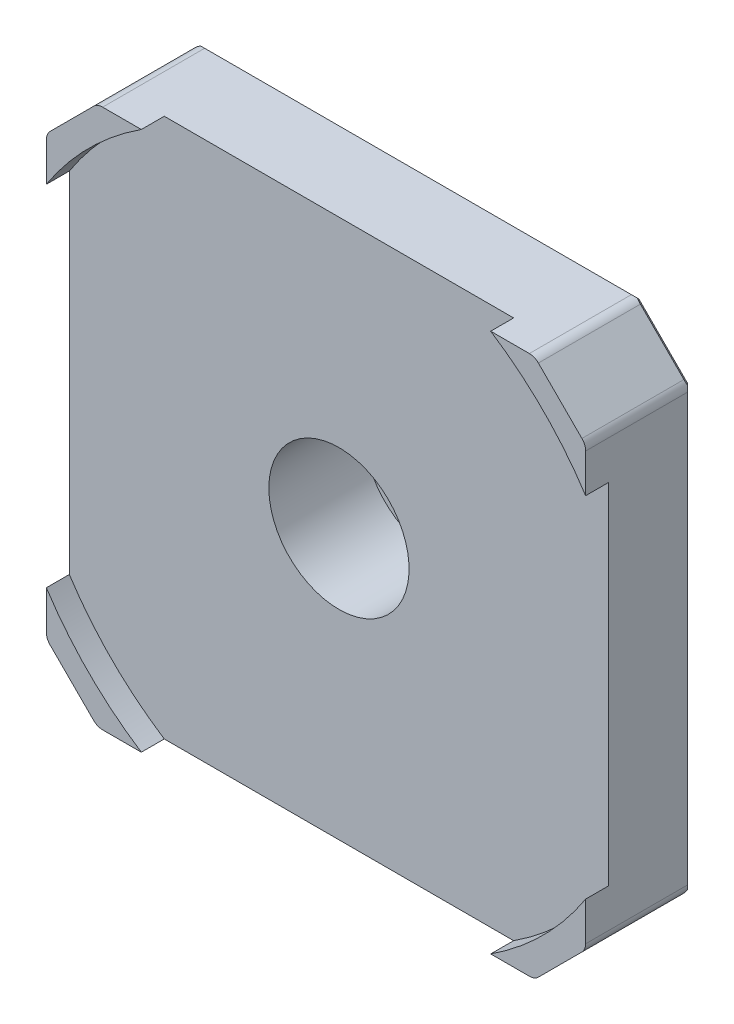
from build123d import *

# Parameters (mm, degrees)
SALIENTE_EXTRUIR1_DEPTH     = 6.5
CROQUIS3_R                  = 11
SALIENTE_EXTRUIR2_DEPTH     = 2
CROQUIS4_R                  = 4.5
CORTAR_EXTRUIR2_DEPTH       = 1
CROQUIS5_R                  = 5.5
CORTAR_EXTRUIR3_DEPTH       = 10
REDONDEO2_SIZE              = 0.3
REDONDEO3_R                 = 0.2
HOLE_WIZARD_M31_D           = 2.5
HOLE_WIZARD_M31_DEPTH       = 5
HOLE_WIZARD_M31_CSINK_D     = 3.6
HOLE_WIZARD_M31_CSINK_ANGLE = 90
HOLE_WIZARD_M31_TIP         = 0.751075774
FILLET_1_R                  = 1
EXTRUDE_START               = 1.8
EXTRUDE_1_DEPTH             = 1.8


with BuildPart() as part:
    # Croquis1 → Saliente-Extruir1 (new body)
    with BuildSketch(Plane.XY):
        Polygon((-21.15, 17.15), (-17.15, 21.15), (17.15, 21.15), (21.15, 17.15), (21.15, -17.15), (17.15, -21.15), (-17.15, -21.15), (-21.15, -17.15), align=None)
    extrude(amount=SALIENTE_EXTRUIR1_DEPTH)

    # Croquis3 → Saliente-Extruir2 (add)
    with BuildSketch(Plane(origin=(0, 0, 0), x_dir=(-1, 0, 0), z_dir=(0, 0, -1))):
        Circle(CROQUIS3_R)
    extrude(amount=SALIENTE_EXTRUIR2_DEPTH)

    # Croquis4 → Cortar-Extruir2 (cut)
    with BuildSketch(Plane(origin=(0, 0, -2), x_dir=(-1, 0, 0), z_dir=(0, 0, -1))):
        Circle(CROQUIS4_R)
    extrude(amount=-CORTAR_EXTRUIR2_DEPTH, mode=Mode.SUBTRACT)

    # Croquis5 → Cortar-Extruir3 (cut)
    with BuildSketch(Plane(origin=(0, 0, -1), x_dir=(-1, 0, 0), z_dir=(0, 0, -1))):
        Circle(CROQUIS5_R)
    extrude(amount=-CORTAR_EXTRUIR3_DEPTH, mode=Mode.SUBTRACT)

    # Redondeo2
    redondeo2_edges = [part.edges().sort_by_distance(p)[0] for p in [
        (-19.15, 19.15, 0),
        (0, 21.15, 0),
        (19.15, 19.15, 0),
        (21.15, 0, 0),
        (19.15, -19.15, 0),
        (0, -21.15, 0),
        (-19.15, -19.15, 0),
        (-21.15, 0, 0),
    ]]
    chamfer(redondeo2_edges, length=REDONDEO2_SIZE)

    # Redondeo3
    redondeo3_edges = [part.edges().sort_by_distance(p)[0] for p in [
        (11, 0, -2),
        (4.5, 0, -2),
    ]]
    fillet(redondeo3_edges, radius=REDONDEO3_R)

    # Отверстие обработанное метчиком M31
    with Locations(Plane(origin=(15.5, 15.5, 0), x_dir=(-1, 0, 0), z_dir=(0, 0, -1))):
        with Locations((0, 0), (31, 0), (31, -31), (0, -31)):
            CounterSinkHole(HOLE_WIZARD_M31_D / 2, HOLE_WIZARD_M31_CSINK_D / 2, depth=HOLE_WIZARD_M31_DEPTH, counter_sink_angle=HOLE_WIZARD_M31_CSINK_ANGLE)
            with Locations((0, 0, -(HOLE_WIZARD_M31_DEPTH + HOLE_WIZARD_M31_TIP / 2))):  # 118° drill point
                Cone(0, HOLE_WIZARD_M31_D / 2, HOLE_WIZARD_M31_TIP, mode=Mode.SUBTRACT)

    # Скругление1
    fillet_1_edges = [part.edges().sort_by_distance(p)[0] for p in [
        (17.15, 21.15, 3.4),
        (21.15, 17.15, 3.4),
        (21.15, -17.15, 3.4),
        (17.15, -21.15, 3.4),
        (-17.15, -21.15, 3.4),
        (-21.15, -17.15, 3.4),
        (-21.15, 17.15, 3.4),
        (-17.15, 21.15, 3.4),
    ]]
    fillet(fillet_1_edges, radius=FILLET_1_R)

    # Эскиз9 → Бобышка-Вытянуть1 (add)
    with BuildSketch(Plane.XY.offset(6.5).offset(EXTRUDE_START)):
        with BuildLine():
            Line((-21.15, -13.701003613), (-21.15, -16.735786438))
            ThreePointArc((-21.15, -16.735786438), (-21.073879533, -17.11846987), (-20.857106781, -17.442893219))
            Line((-20.857106781, -17.442893219), (-17.442893219, -20.857106781))
            ThreePointArc((-17.442893219, -20.857106781), (-17.11846987, -21.073879533), (-16.735786438, -21.15))
            Line((-16.735786438, -21.15), (-13.701003613, -21.15))
            ThreePointArc((-13.701003613, -21.15), (-17.819090886, -17.819090886), (-21.15, -13.701003613))
        make_face()
        with BuildLine():
            Line((-13.701003613, 21.15), (-16.735786438, 21.15))
            ThreePointArc((-16.735786438, 21.15), (-17.11846987, 21.073879533), (-17.442893219, 20.857106781))
            Line((-17.442893219, 20.857106781), (-20.857106781, 17.442893219))
            ThreePointArc((-20.857106781, 17.442893219), (-21.073879533, 17.11846987), (-21.15, 16.735786438))
            Line((-21.15, 16.735786438), (-21.15, 13.701003613))
            ThreePointArc((-21.15, 13.701003613), (-17.819090886, 17.819090886), (-13.701003613, 21.15))
        make_face()
        with BuildLine():
            Line((21.15, 13.701003613), (21.15, 16.735786438))
            ThreePointArc((21.15, 16.735786438), (21.073879533, 17.11846987), (20.857106781, 17.442893219))
            Line((20.857106781, 17.442893219), (17.442893219, 20.857106781))
            ThreePointArc((17.442893219, 20.857106781), (17.11846987, 21.073879533), (16.735786438, 21.15))
            Line((16.735786438, 21.15), (13.701003613, 21.15))
            ThreePointArc((13.701003613, 21.15), (17.819090886, 17.819090886), (21.15, 13.701003613))
        make_face()
        with BuildLine():
            Line((13.701003613, -21.15), (16.735786438, -21.15))
            ThreePointArc((16.735786438, -21.15), (17.11846987, -21.073879533), (17.442893219, -20.857106781))
            Line((17.442893219, -20.857106781), (20.857106781, -17.442893219))
            ThreePointArc((20.857106781, -17.442893219), (21.073879533, -17.11846987), (21.15, -16.735786438))
            Line((21.15, -16.735786438), (21.15, -13.701003613))
            ThreePointArc((21.15, -13.701003613), (17.819090886, -17.819090886), (13.701003613, -21.15))
        make_face()
    extrude(amount=-EXTRUDE_1_DEPTH)


solid = part.part
